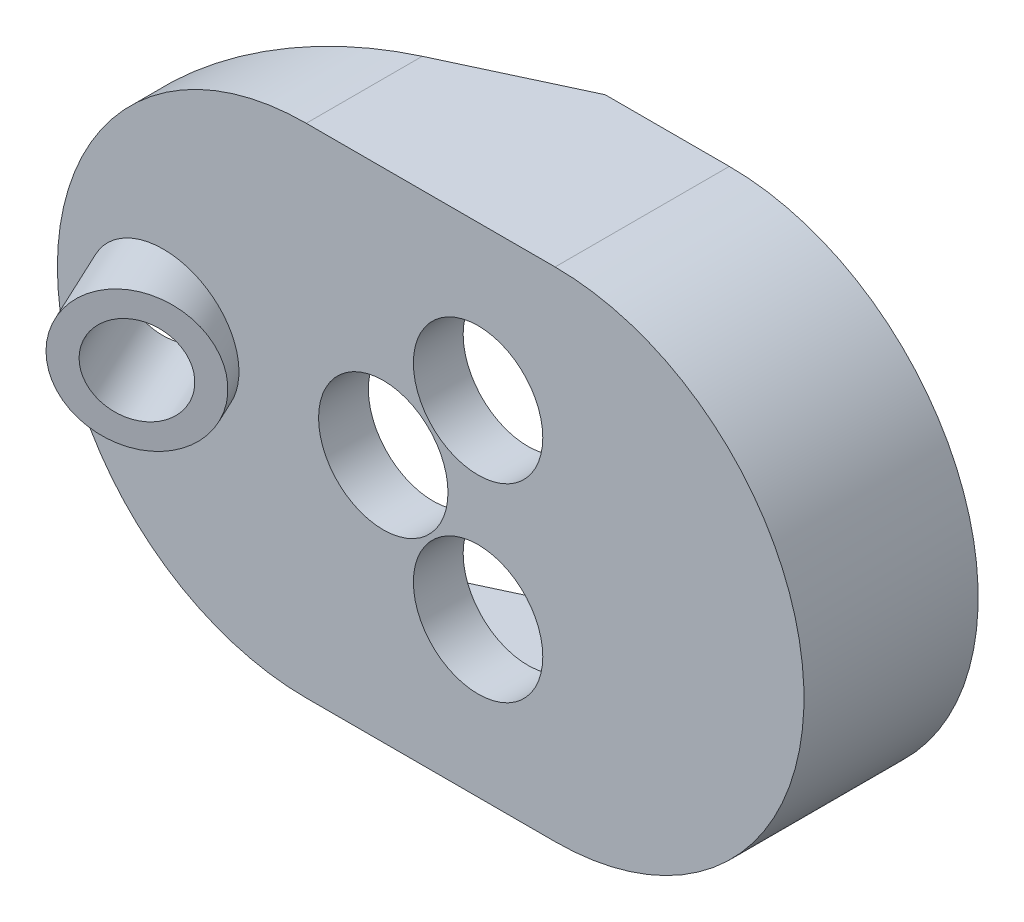
from build123d import *

# Parameters (mm, degrees)
SKETCH3_R           = 2.6
BOSS_EXTRUDE1_DEPTH = 7
SKETCH4_W           = 16
SKETCH4_H           = 16
CUT_EXTRUDE1_DEPTH  = 5
SKETCH5_R           = 2
CUT_EXTRUDE2_DEPTH  = 4
CUT_EXTRUDE3_DEPTH  = 26.961509971
SKETCH8_R           = 1.75
CUT_EXTRUDE4_DEPTH  = 20.33907899
SKETCH9_R           = 2.75
SKETCH9_R_2         = 1.75
BOSS_EXTRUDE3_DEPTH = 4


with BuildPart() as part:
    # Sketch3 → Boss-Extrude1 (new body)
    with BuildSketch(Plane.XY):
        with BuildLine():
            Line((-5, 10), (5, 10))
            ThreePointArc((5, 10), (15, 0), (5, -10))
            Line((5, -10), (-5, -10))
            ThreePointArc((-5, -10), (-15, 0), (-5, 10))
        make_face()
        with Locations((1.905, 3.81)):
            Circle(SKETCH3_R, mode=Mode.SUBTRACT)
        with Locations((1.905, -3.81)):
            Circle(SKETCH3_R, mode=Mode.SUBTRACT)
        with Locations((-1.905, 0)):
            Circle(SKETCH3_R, mode=Mode.SUBTRACT)
    extrude(amount=BOSS_EXTRUDE1_DEPTH)

    # Sketch4 → Cut-Extrude1 (cut)
    with BuildSketch(Plane(origin=(0, 0, 0), x_dir=(-1, 0, 0), z_dir=(0, 0, -1))):
        Rectangle(SKETCH4_W, SKETCH4_H)
    extrude(amount=-CUT_EXTRUDE1_DEPTH, mode=Mode.SUBTRACT)

    # Sketch5 → Cut-Extrude2 (cut)
    with BuildSketch(Plane(origin=(0, 0, 0), x_dir=(-1, 0, 0), z_dir=(0, 0, -1))):
        with Locations((-11.5, -2.5)):
            Circle(SKETCH5_R)
        with Locations((-11.5, 2.5)):
            Circle(SKETCH5_R)
    extrude(amount=-CUT_EXTRUDE2_DEPTH, mode=Mode.SUBTRACT)

    # Sketch6 → Cut-Extrude3 (cut, through all)
    with BuildSketch(Plane.XZ.offset(10)):
        Polygon((-5, 2.336923418), (-15, 7), (-15, 0), (-5, 0), align=None)
        Polygon((0.011548444, 0), (-5, 2.336923418), (-5, 0), align=None)
    extrude(amount=-CUT_EXTRUDE3_DEPTH, mode=Mode.SUBTRACT)

    # Sketch8 → Cut-Extrude4 (cut, through all)
    with BuildSketch(Plane(origin=(0.002062624, 0, 0.004423311), x_dir=(-0.9063077870366496, 0, 0.42261826174070033), z_dir=(-0.4226182617407003, 0, -0.9063077870366495))):
        with Locations((12.691121921, 0)):
            Circle(SKETCH8_R)
    extrude(amount=-CUT_EXTRUDE4_DEPTH, mode=Mode.SUBTRACT)

    # Sketch9 → Boss-Extrude3 (add)
    with BuildSketch(Plane(origin=(0.002062624, 0, 0.004423311), x_dir=(-0.9063077870366496, 0, 0.42261826174070033), z_dir=(-0.4226182617407003, 0, -0.9063077870366495))):
        with Locations((12.691121921, 0)):
            Circle(SKETCH9_R)
        with Locations((12.691121921, 0)):
            Circle(SKETCH9_R_2, mode=Mode.SUBTRACT)
    extrude(amount=-BOSS_EXTRUDE3_DEPTH)


solid = part.part
